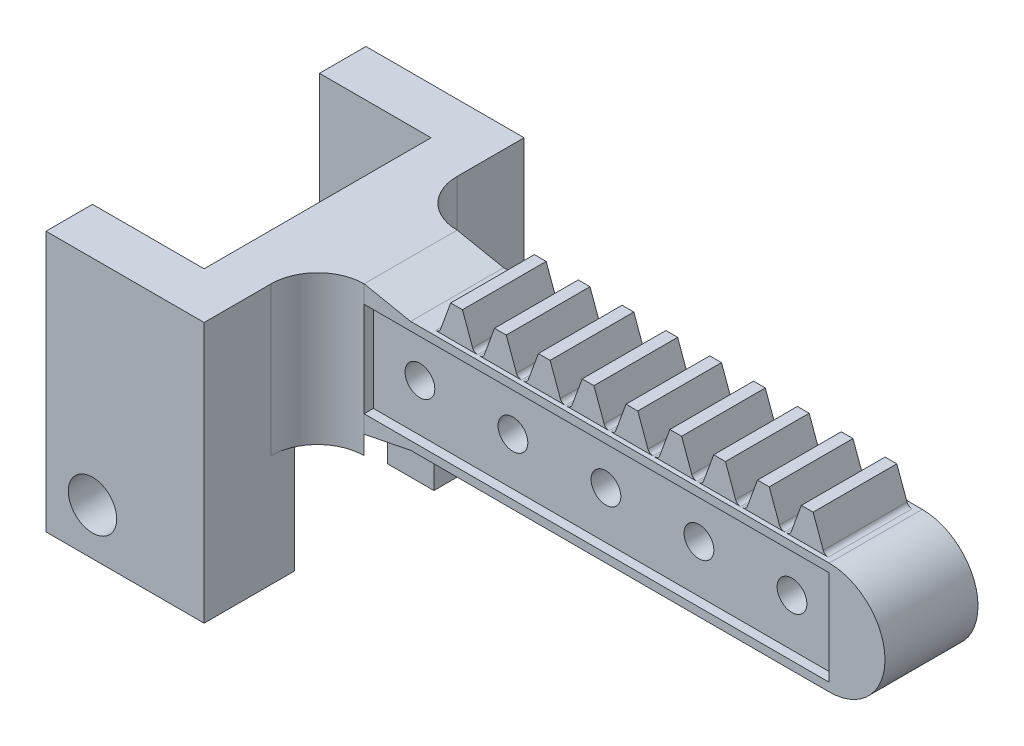
from build123d import *

# Parameters (mm, degrees)
MAIN_EXTRUSION_DEPTH          = 5
TOOTH_DEPTH                   = 4.5
TOOTH_FILLET_R                = 0.57
TOOTHREPEAT_COUNT             = 9
TOOTHREPEAT_PITCH             = 4.71238898
TOOTH_FILLET_OF_TOOTHREPEAT_R = 0.57
FIXINGSUPPORT_DEPTH           = 28
ESQUISSE11_R                  = 2.6
FIXINGHOLES_DEPTH             = 64.832671885
ESQUISSE12_W                  = 15
ESQUISSE12_H                  = 12
RACKHOLE_DEPTH                = 67.767057746
FILLET_2_DEPTH                = 16
ESQUISSE15_W                  = 50
ESQUISSE15_H                  = 10.2
REINFORCEMENT_DEPTH           = 1
ESQUISSE16_R                  = 1.6
ENL_V_MAT_EXTRU_2_DEPTH       = 58.798702408


with BuildPart() as part:
    # Esquisse1 → Main Extrusion (new, symmetric)
    with BuildSketch(Plane.XY):
        with BuildLine():
            Line((-22.5, 6), (-27.5, 7))
            Line((-27.5, 7), (-32.5, 7))
            Line((-32.5, 7), (-32.5, -7))
            Line((-32.5, -7), (-27.5, -7))
            Line((-27.5, -7), (-22.5, -6))
            Line((-22.5, -6), (22.5, -6))
            ThreePointArc((22.5, -6), (28.5, 0), (22.5, 6))
            Line((22.5, 6), (-22.5, 6))
        make_face()
    extrude(amount=MAIN_EXTRUSION_DEPTH, both=True)

    # Esquisse5 → Tooth (add, symmetric)
    with BuildSketch(Plane.XY):
        Polygon((17.778917131, 6), (19.007316672, 9.375), (20.271600459, 9.375), (21.5, 6), align=None)
    tooth = extrude(amount=TOOTH_DEPTH, both=True)

    # Tooth Fillet
    tooth_fillet_edges = [part.edges().sort_by_distance(p)[0] for p in [
        (17.778917131, 6, 0),
        (21.5, 6, 0),
    ]]
    fillet(tooth_fillet_edges, radius=TOOTH_FILLET_R)

    # ToothRepeat: Tooth ×9
    with Locations(*[(-i * TOOTHREPEAT_PITCH, 0, 0) for i in range(1, TOOTHREPEAT_COUNT)]):
        add(tooth)

    # Tooth Fillet of ToothRepeat
    tooth_fillet_of_toothrepeat_edges = [part.edges().sort_by_distance(p)[0] for p in [
        (13.066528151, 6, 0),
        (16.78761102, 6, 0),
        (8.354139171, 6, 0),
        (12.07522204, 6, 0),
        (3.641750191, 6, 0),
        (7.36283306, 6, 0),
        (-1.070638789, 6, 0),
        (2.65044408, 6, 0),
        (-5.783027769, 6, 0),
        (-2.0619449, 6, 0),
        (-10.495416749, 6, 0),
        (-6.77433388, 6, 0),
        (-15.207805729, 6, 0),
        (-11.48672286, 6, 0),
        (-19.920194709, 6, 0),
        (-16.19911184, 6, 0),
    ]]
    fillet(tooth_fillet_of_toothrepeat_edges, radius=TOOTH_FILLET_OF_TOOTHREPEAT_R)



with BuildPart() as body_2:
    # Esquisse10 → FixingSupport (new body)
    with BuildSketch(Plane(origin=(0, 7, 0), x_dir=(1, 0, 0), z_dir=(0, 1, 0))):
        Polygon((-32.5, -17.2), (-49.5, -17.2), (-49.5, -12.2), (-37.5, -12.2), (-37.5, 12.2), (-49.5, 12.2), (-49.5, 17.2), (-32.5, 17.2), align=None)
    extrude(amount=-FIXINGSUPPORT_DEPTH)

    # Esquisse11 → FixingHoles (cut, through all)
    with BuildSketch(Plane.XY.offset(17.2)):
        with Locations((-44.5, -16)):
            Circle(ESQUISSE11_R)
    extrude(amount=-FIXINGHOLES_DEPTH, mode=Mode.SUBTRACT)

    # Esquisse12 → RackHole (cut, through all)
    with BuildSketch(Plane(origin=(-32.5, 0, 0), x_dir=(0, 0, -1), z_dir=(1, 0, 0))):
        with Locations((0, -15)):
            Rectangle(ESQUISSE12_W, ESQUISSE12_H)
    extrude(amount=-RACKHOLE_DEPTH, mode=Mode.SUBTRACT)


with BuildPart() as part_1:
    add(part.part)

    add(body_2.part)  # Fillet 2 merges body 2
    # Esquisse14 → Fillet 2 (add)
    with BuildSketch(Plane(origin=(0, 7, 0), x_dir=(1, 0, 0), z_dir=(0, 1, 0))):
        with BuildLine():
            Line((-32.5, -5), (-32.5, -10))
            ThreePointArc((-32.5, -10), (-31.035533906, -6.464466094), (-27.5, -5))
            Line((-27.5, -5), (-32.5, -5))
        make_face()
    fillet_2 = extrude(amount=-FILLET_2_DEPTH)

    # FilletSymetry: Fillet 2 across plane
    add(fillet_2.mirror(Plane.XY))

    # Esquisse15 → Reinforcement (cut)
    with BuildSketch(Plane.XY.offset(5)):
        with Locations((-2.5, 0)):
            Rectangle(ESQUISSE15_W, ESQUISSE15_H)
    reinforcement = extrude(amount=-REINFORCEMENT_DEPTH, mode=Mode.SUBTRACT)

    # Symétrie1: Reinforcement across plane
    add(reinforcement.mirror(Plane.XY), mode=Mode.SUBTRACT)

    # Esquisse16 → Enlèv. mat.-Extru.2 (cut, through all)
    with BuildSketch(Plane.XY.offset(4)):
        with Locations((17.5, 0)):
            Circle(ESQUISSE16_R)
        with Locations((7.5, 0)):
            Circle(ESQUISSE16_R)
        with Locations((-2.5, 0)):
            Circle(ESQUISSE16_R)
        with Locations((-12.5, 0)):
            Circle(ESQUISSE16_R)
        with Locations((-22.5, 0)):
            Circle(ESQUISSE16_R)
    extrude(amount=-ENL_V_MAT_EXTRU_2_DEPTH, mode=Mode.SUBTRACT)


solid = part_1.part
